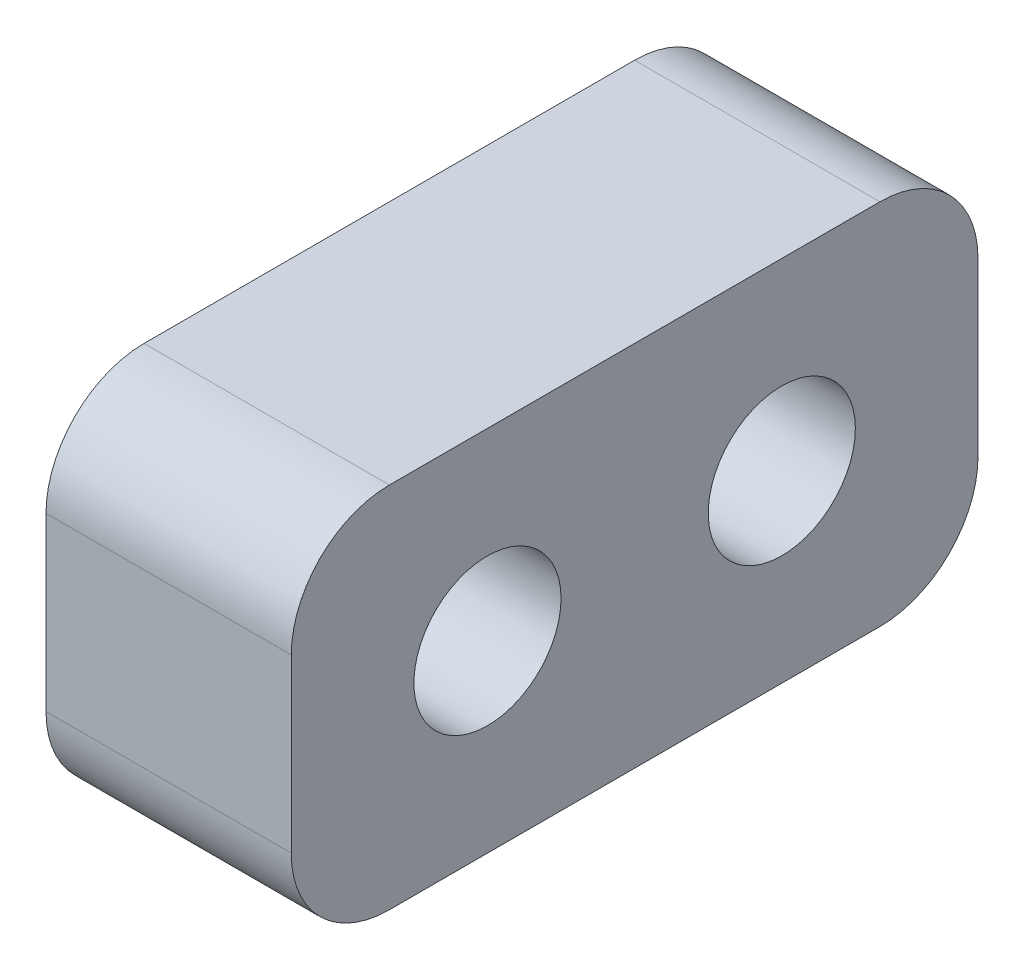
from build123d import *

# Parameters (mm, degrees)
SKETCH1_R           = 1.5
BOSS_EXTRUDE1_DEPTH = 5


with BuildPart() as part:
    # Sketch1 → Boss-Extrude1 (new body)
    with BuildSketch(Plane.YZ):
        with BuildLine():
            Line((0, 2), (0, 12))
            ThreePointArc((0, 12), (0.585786438, 13.414213562), (2, 14))
            Line((2, 14), (5.5, 14))
            ThreePointArc((5.5, 14), (6.914213562, 13.414213562), (7.5, 12))
            Line((7.5, 12), (7.5, 2))
            ThreePointArc((7.5, 2), (6.914213562, 0.585786438), (5.5, 0))
            Line((5.5, 0), (2, 0))
            ThreePointArc((2, 0), (0.585786438, 0.585786438), (0, 2))
        make_face()
        with Locations(Location((3.75, 10, 0), (0, 0, 270))):
            Circle(SKETCH1_R, mode=Mode.SUBTRACT)
        with Locations(Location((3.75, 4, 0), (0, 0, 270))):
            Circle(SKETCH1_R, mode=Mode.SUBTRACT)
    extrude(amount=BOSS_EXTRUDE1_DEPTH)


solid = part.part
